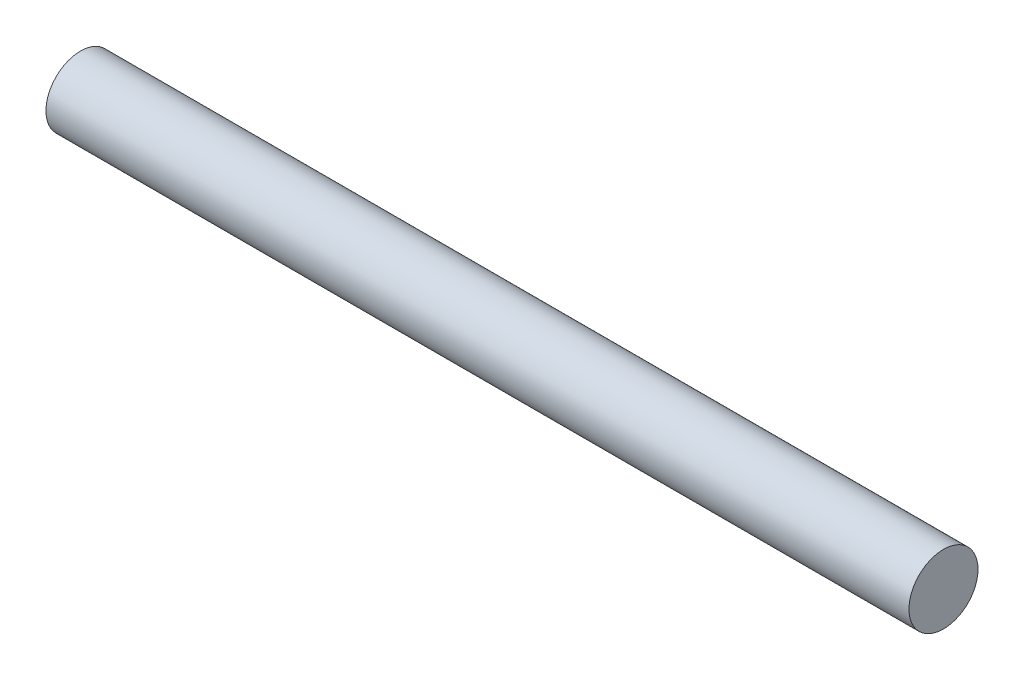
from build123d import *

# Parameters (mm, degrees)
SKETCH1_R           = 4
BOSS_EXTRUDE1_DEPTH = 50


with BuildPart() as part:
    # Sketch1 → Boss-Extrude1 (new, symmetric)
    with BuildSketch(Plane(origin=(0, 0, 0), x_dir=(0, 0, -1), z_dir=(1, 0, 0))):
        Circle(SKETCH1_R)
    extrude(amount=BOSS_EXTRUDE1_DEPTH, both=True)


solid = part.part
